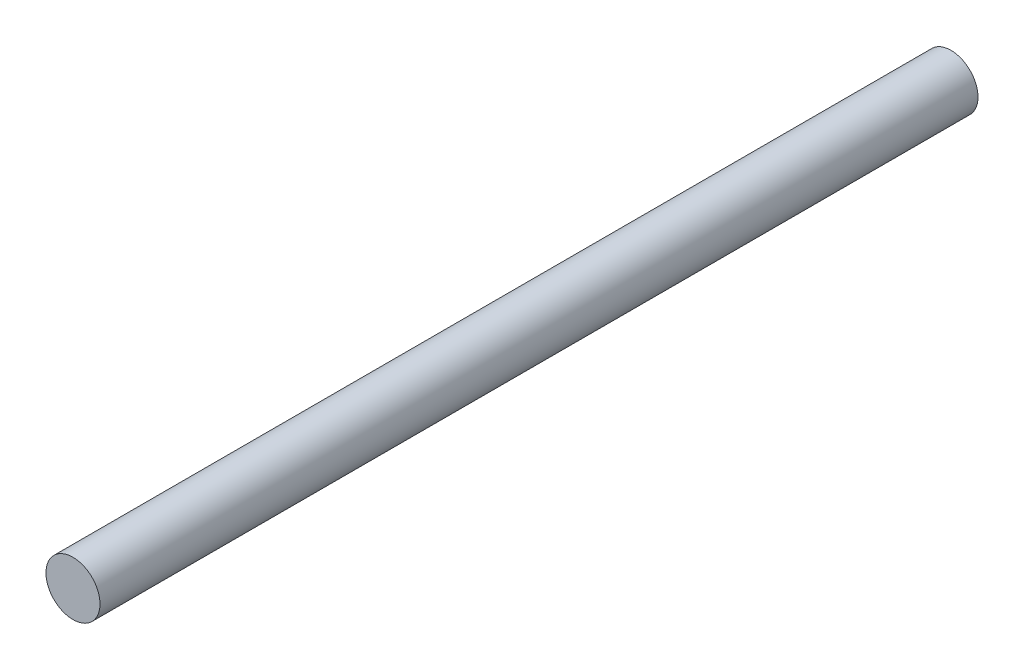
from build123d import *

# Parameters (mm, degrees)
SKETCH_1_R      = 4
EXTRUDE_1_DEPTH = 130


with BuildPart() as part:
    # 草图1 → 凸台-拉伸1 (new body)
    with BuildSketch(Plane.XY):
        Circle(SKETCH_1_R)
    extrude(amount=EXTRUDE_1_DEPTH)


solid = part.part
